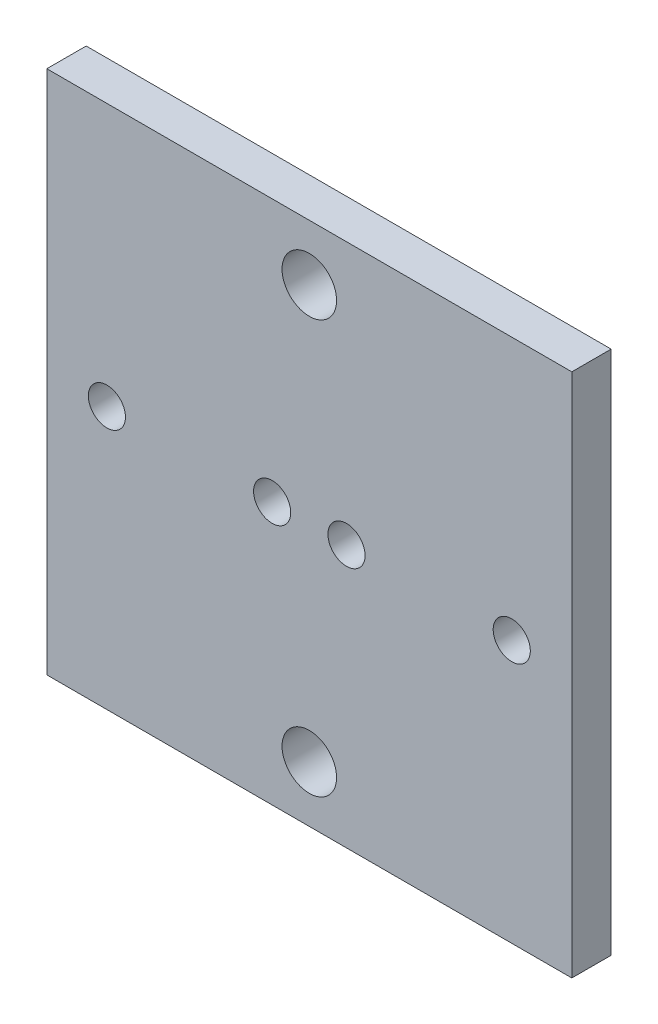
from build123d import *

# Parameters (mm, degrees)
SKETCH1_W            = 25.42
SKETCH1_H            = 25.42
BOSS_EXTRUDE5_DEPTH  = 4.7625
SKETCH3_W            = 4.7625
SKETCH3_H            = 61
BOSS_EXTRUDE6_DEPTH  = 1.27
SKETCH4_W            = 4.7625
SKETCH4_H            = 61
BOSS_EXTRUDE9_DEPTH  = 1.27
SKETCH6_W            = 63.54
SKETCH6_H            = 4.7625
BOSS_EXTRUDE10_DEPTH = 1.27
SKETCH7_W            = 63.54
SKETCH7_H            = 4.7625
BOSS_EXTRUDE11_DEPTH = 1.27


with BuildPart() as part:
    # Sketch1 → Boss-Extrude5 (new body)
    with BuildSketch(Plane.XY):
        with BuildLine():
            Line((0, 28.3), (0, 30.5))
            Line((0, 30.5), (-5.08, 30.5))
            Line((-5.08, 30.5), (-5.08, 5.08))
            Line((-5.08, 5.08), (0, 5.08))
            Line((0, 5.08), (0, 21.7))
            ThreePointArc((0, 21.7), (-3.3, 25), (0, 28.3))
        make_face()
        with BuildLine():
            Line((5.08, 30.5), (0, 30.5))
            Line((0, 30.5), (0, 28.3))
            ThreePointArc((0, 28.3), (2.333452378, 27.333452378), (3.3, 25))
            ThreePointArc((3.3, 25), (2.333452378, 22.666547622), (0, 21.7))
            Line((0, 21.7), (0, 5.08))
            Line((0, 5.08), (5.08, 5.08))
            Line((5.08, 5.08), (5.08, 30.5))
        make_face()
        with BuildLine():
            Line((30.5, 5.08), (5.08, 5.08))
            Line((5.08, 5.08), (5.08, 2.171785995))
            ThreePointArc((5.08, 2.171785995), (6.282811882, 1.369173548), (6.7479, 0))
            Line((6.7479, 0), (22.2521, 0))
            ThreePointArc((22.2521, 0), (24.5, 2.2479), (26.7479, 0))
            Line((26.7479, 0), (30.5, 0))
            Line((30.5, 0), (30.5, 5.08))
        make_face()
        with BuildLine():
            Line((22.2521, 0), (6.7479, 0))
            ThreePointArc((6.7479, 0), (6.282811882, -1.369173548), (5.08, -2.171785995))
            Line((5.08, -2.171785995), (5.08, -5.08))
            Line((5.08, -5.08), (30.5, -5.08))
            Line((30.5, -5.08), (30.5, 0))
            Line((30.5, 0), (26.7479, 0))
            ThreePointArc((26.7479, 0), (24.5, -2.2479), (22.2521, 0))
        make_face()
        with BuildLine():
            Line((2.2521, 0), (0, 0))
            Line((0, 0), (0, -5.08))
            Line((0, -5.08), (5.08, -5.08))
            Line((5.08, -5.08), (5.08, -2.171785995))
            ThreePointArc((5.08, -2.171785995), (3.130826452, -1.782811882), (2.2521, 0))
        make_face()
        with BuildLine():
            Line((0, -5.08), (0, 0))
            Line((0, 0), (-2.2521, 0))
            ThreePointArc((-2.2521, 0), (-3.130826452, -1.782811882), (-5.08, -2.171785995))
            Line((-5.08, -2.171785995), (-5.08, -5.08))
            Line((-5.08, -5.08), (0, -5.08))
        make_face()
        with BuildLine():
            Line((5.08, 2.171785995), (5.08, 5.08))
            Line((5.08, 5.08), (0, 5.08))
            Line((0, 5.08), (0, 0))
            Line((0, 0), (2.2521, 0))
            ThreePointArc((2.2521, 0), (3.130826452, 1.782811882), (5.08, 2.171785995))
        make_face()
        with BuildLine():
            Line((0, 5.08), (-5.08, 5.08))
            Line((-5.08, 5.08), (-5.08, 2.171785995))
            ThreePointArc((-5.08, 2.171785995), (-3.130826452, 1.782811882), (-2.2521, 0))
            Line((-2.2521, 0), (0, 0))
            Line((0, 0), (0, 5.08))
        make_face()
        with BuildLine():
            Line((-5.08, 2.171785995), (-5.08, 5.08))
            Line((-5.08, 5.08), (-30.5, 5.08))
            Line((-30.5, 5.08), (-30.5, 0))
            Line((-30.5, 0), (-26.7479, 0))
            ThreePointArc((-26.7479, 0), (-24.5, 2.2479), (-22.2521, 0))
            Line((-22.2521, 0), (-6.7479, 0))
            ThreePointArc((-6.7479, 0), (-6.282811882, 1.369173548), (-5.08, 2.171785995))
        make_face()
        with BuildLine():
            ThreePointArc((-5.08, -2.171785995), (-6.282811882, -1.369173548), (-6.7479, 0))
            Line((-6.7479, 0), (-22.2521, 0))
            ThreePointArc((-22.2521, 0), (-24.5, -2.2479), (-26.7479, 0))
            Line((-26.7479, 0), (-30.5, 0))
            Line((-30.5, 0), (-30.5, -5.08))
            Line((-30.5, -5.08), (-5.08, -5.08))
            Line((-5.08, -5.08), (-5.08, -2.171785995))
        make_face()
        with BuildLine():
            Line((0, -21.7), (0, -5.08))
            Line((0, -5.08), (-5.08, -5.08))
            Line((-5.08, -5.08), (-5.08, -30.5))
            Line((-5.08, -30.5), (0, -30.5))
            Line((0, -30.5), (0, -28.3))
            ThreePointArc((0, -28.3), (-3.3, -25), (0, -21.7))
        make_face()
        with BuildLine():
            Line((5.08, -5.08), (0, -5.08))
            Line((0, -5.08), (0, -21.7))
            ThreePointArc((0, -21.7), (2.333452378, -22.666547622), (3.3, -25))
            ThreePointArc((3.3, -25), (2.333452378, -27.333452378), (0, -28.3))
            Line((0, -28.3), (0, -30.5))
            Line((0, -30.5), (5.08, -30.5))
            Line((5.08, -30.5), (5.08, -5.08))
        make_face()
        with Locations((-17.79, 17.79)):
            Rectangle(SKETCH1_W, SKETCH1_H)
        with Locations((17.79, 17.79)):
            Rectangle(SKETCH1_W, SKETCH1_H)
        with Locations((17.79, -17.79)):
            Rectangle(SKETCH1_W, SKETCH1_H)
        with Locations((-17.79, -17.79)):
            Rectangle(SKETCH1_W, SKETCH1_H)
    extrude(amount=BOSS_EXTRUDE5_DEPTH)

    # Sketch3 → Boss-Extrude6 (add)
    with BuildSketch(Plane.ZY.offset(30.5)):
        with Locations((2.38125, 0)):
            Rectangle(SKETCH3_W, SKETCH3_H)
    extrude(amount=BOSS_EXTRUDE6_DEPTH)

    # Sketch4 → Boss-Extrude9 (add)
    with BuildSketch(Plane(origin=(30.5, 0, 0), x_dir=(0, 0, -1), z_dir=(1, 0, 0))):
        with Locations((-2.38125, 0)):
            Rectangle(SKETCH4_W, SKETCH4_H)
    extrude(amount=BOSS_EXTRUDE9_DEPTH)

    # Sketch6 → Boss-Extrude10 (add)
    with BuildSketch(Plane.XZ.offset(30.5)):
        with Locations((0, 2.38125)):
            Rectangle(SKETCH6_W, SKETCH6_H)
    extrude(amount=BOSS_EXTRUDE10_DEPTH)

    # Sketch7 → Boss-Extrude11 (add)
    with BuildSketch(Plane(origin=(0, 30.5, 0), x_dir=(1, 0, 0), z_dir=(0, 1, 0))):
        with Locations((0, -2.38125)):
            Rectangle(SKETCH7_W, SKETCH7_H)
    extrude(amount=BOSS_EXTRUDE11_DEPTH)


solid = part.part
